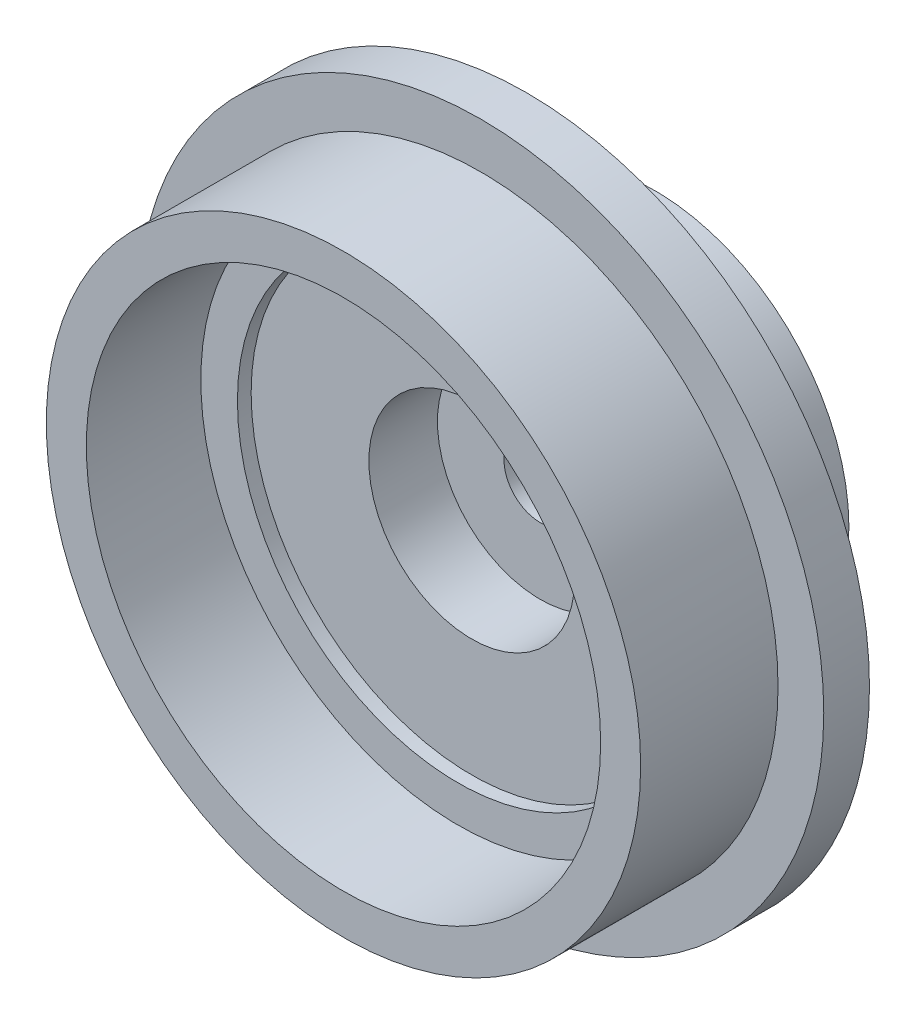
from build123d import *

# Parameters (mm, degrees)
SKETCH2_R          = 2.0193
CUT_EXTRUDE1_DEPTH = 29.792891484
SKETCH3_R          = 5.715
CUT_EXTRUDE2_DEPTH = 3.81


with BuildPart() as part:
    # Sketch1 → Revolve1 (revolve)
    with BuildSketch(Plane(origin=(0, 0, 0), x_dir=(0, 0, -1), z_dir=(1, 0, 0)), mode=Mode.PRIVATE) as revolve1_sk:
        Polygon((17.2847, 0), (7.1247, 0), (7.1247, 12.2555), (6.3627, 12.2555), (6.3627, 14.2875), (0, 14.2875), (0, 16.51), (7.6327, 16.51), (7.6327, 19.05), (10.1727, 19.05), (10.1727, 10.795), (17.2847, 10.795), align=None)
    revolve(revolve1_sk.sketch.rotate(Axis((0, 0, 32.351737074), (0, 0, -1)), 90), axis=Axis((0, 0, 32.351737074), (0, 0, -1)))

    # Sketch2 → Cut-Extrude1 (cut, through all)
    with BuildSketch(Plane.XY.offset(-7.1247)):
        Circle(SKETCH2_R)
    extrude(amount=-CUT_EXTRUDE1_DEPTH, mode=Mode.SUBTRACT)

    # Sketch3 → Cut-Extrude2 (cut)
    with BuildSketch(Plane.XY.offset(-7.1247)):
        Circle(SKETCH3_R)
    extrude(amount=-CUT_EXTRUDE2_DEPTH, mode=Mode.SUBTRACT)


solid = part.part
